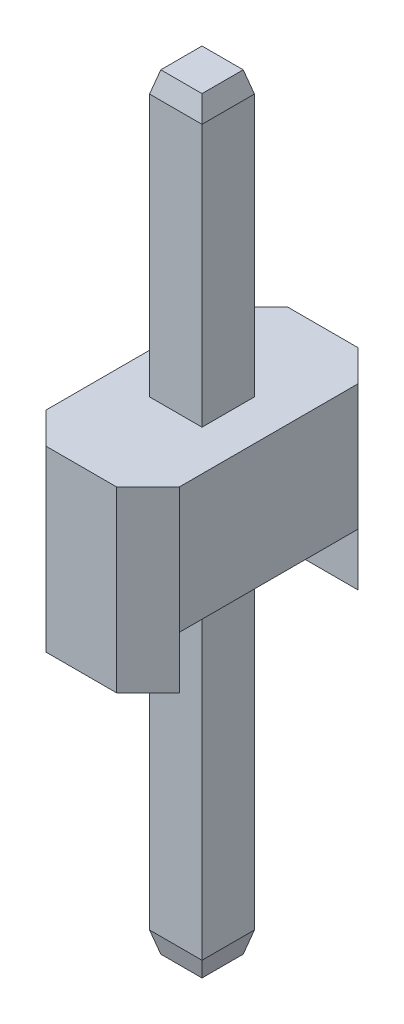
from build123d import *
from OCP.BRepFilletAPI import BRepFilletAPI_MakeChamfer

# Parameters (mm, degrees)
SKETCH1_W           = 1.27
SKETCH1_H           = 2.3
BOSS_EXTRUDE1_DEPTH = 1.7
CHAMFER1_SIZE       = 0.3
SKETCH2_W           = 1.27
SKETCH2_H           = 1.7
CUT_EXTRUDE1_DEPTH  = 0.5
SKETCH3_W           = 0.5
SKETCH3_H           = 0.5
BOSS_EXTRUDE2_DEPTH = 2.7
SKETCH4_W           = 0.5
SKETCH4_H           = 0.5
BOSS_EXTRUDE3_DEPTH = 3.4
CHAMFER3_SIZE       = 0.2
CHAMFER3_SIZE2      = 0.053589838


with BuildPart() as part:
    # Sketch1 → Boss-Extrude1 (new body)
    with BuildSketch(Plane(origin=(0, 0, 0), x_dir=(1, 0, 0), z_dir=(0, 1, 0))):
        Rectangle(SKETCH1_W, SKETCH1_H)
    extrude(amount=BOSS_EXTRUDE1_DEPTH)

    # Chamfer1
    chamfer1_edges = [part.edges().sort_by_distance(p)[0] for p in [
        (-0.635, 0.85, -1.15),
        (0.635, 0.85, -1.15),
        (0.635, 0.85, 1.15),
        (-0.635, 0.85, 1.15),
    ]]
    chamfer(chamfer1_edges, length=CHAMFER1_SIZE)

    # Sketch2 → Cut-Extrude1 (cut)
    with BuildSketch(Plane.XZ):
        Rectangle(SKETCH2_W, SKETCH2_H)
    extrude(amount=-CUT_EXTRUDE1_DEPTH, mode=Mode.SUBTRACT)

    # Sketch3 → Boss-Extrude2 (add)
    with BuildSketch(Plane(origin=(0, 1.7, 0), x_dir=(1, 0, 0), z_dir=(0, 1, 0))):
        Rectangle(SKETCH3_W, SKETCH3_H)
    extrude(amount=BOSS_EXTRUDE2_DEPTH)

    # Sketch4 → Boss-Extrude3 (add)
    with BuildSketch(Plane.XZ.offset(-0.5)):
        Rectangle(SKETCH4_W, SKETCH4_H)
    extrude(amount=BOSS_EXTRUDE3_DEPTH)

    # Chamfer3: one chamfer whose edges measure the first distance from different faces: ONE call of the kernel's chamfer builder (chamfer() names one face for all edges)
    chamfer3_edges_1 = [part.edges().sort_by_distance(p)[0] for p in [
        (0.25, 4.4, 0),
    ]]
    chamfer3_side_1 = [part.faces().sort_by_distance(p)[0] for p in [
        (0.25, 3.05, 0),
    ]]
    chamfer3_edges_2 = [part.edges().sort_by_distance(p)[0] for p in [
        (0, 4.4, -0.25),
    ]]
    chamfer3_side_2 = [part.faces().sort_by_distance(p)[0] for p in [
        (0, 3.05, -0.25),
    ]]
    chamfer3_edges_3 = [part.edges().sort_by_distance(p)[0] for p in [
        (-0.25, 4.4, 0),
    ]]
    chamfer3_side_3 = [part.faces().sort_by_distance(p)[0] for p in [
        (-0.25, 3.05, 0),
    ]]
    chamfer3_edges_4 = [part.edges().sort_by_distance(p)[0] for p in [
        (0, 4.4, 0.25),
    ]]
    chamfer3_side_4 = [part.faces().sort_by_distance(p)[0] for p in [
        (0, 3.05, 0.25),
    ]]
    chamfer3_edges_5 = [part.edges().sort_by_distance(p)[0] for p in [
        (0, -2.9, 0.25),
    ]]
    chamfer3_side_5 = [part.faces().sort_by_distance(p)[0] for p in [
        (0, -1.2, 0.25),
    ]]
    chamfer3_edges_6 = [part.edges().sort_by_distance(p)[0] for p in [
        (0.25, -2.9, 0),
    ]]
    chamfer3_side_6 = [part.faces().sort_by_distance(p)[0] for p in [
        (0.25, -1.2, 0),
    ]]
    chamfer3_edges_7 = [part.edges().sort_by_distance(p)[0] for p in [
        (0, -2.9, -0.25),
    ]]
    chamfer3_side_7 = [part.faces().sort_by_distance(p)[0] for p in [
        (0, -1.2, -0.25),
    ]]
    chamfer3_edges_8 = [part.edges().sort_by_distance(p)[0] for p in [
        (-0.25, -2.9, 0),
    ]]
    chamfer3_side_8 = [part.faces().sort_by_distance(p)[0] for p in [
        (-0.25, -1.2, 0),
    ]]
    chamfer3 = BRepFilletAPI_MakeChamfer(part.part.solid().wrapped)
    for e in chamfer3_edges_1:
        chamfer3.Add(CHAMFER3_SIZE, CHAMFER3_SIZE2, e.wrapped, chamfer3_side_1[0].wrapped)  # the first distance lies on this face
    for e in chamfer3_edges_2:
        chamfer3.Add(CHAMFER3_SIZE, CHAMFER3_SIZE2, e.wrapped, chamfer3_side_2[0].wrapped)  # the first distance lies on this face
    for e in chamfer3_edges_3:
        chamfer3.Add(CHAMFER3_SIZE, CHAMFER3_SIZE2, e.wrapped, chamfer3_side_3[0].wrapped)  # the first distance lies on this face
    for e in chamfer3_edges_4:
        chamfer3.Add(CHAMFER3_SIZE, CHAMFER3_SIZE2, e.wrapped, chamfer3_side_4[0].wrapped)  # the first distance lies on this face
    for e in chamfer3_edges_5:
        chamfer3.Add(CHAMFER3_SIZE, CHAMFER3_SIZE2, e.wrapped, chamfer3_side_5[0].wrapped)  # the first distance lies on this face
    for e in chamfer3_edges_6:
        chamfer3.Add(CHAMFER3_SIZE, CHAMFER3_SIZE2, e.wrapped, chamfer3_side_6[0].wrapped)  # the first distance lies on this face
    for e in chamfer3_edges_7:
        chamfer3.Add(CHAMFER3_SIZE, CHAMFER3_SIZE2, e.wrapped, chamfer3_side_7[0].wrapped)  # the first distance lies on this face
    for e in chamfer3_edges_8:
        chamfer3.Add(CHAMFER3_SIZE, CHAMFER3_SIZE2, e.wrapped, chamfer3_side_8[0].wrapped)  # the first distance lies on this face
    add(Compound.cast(chamfer3.Shape()), mode=Mode.REPLACE)


solid = part.part
